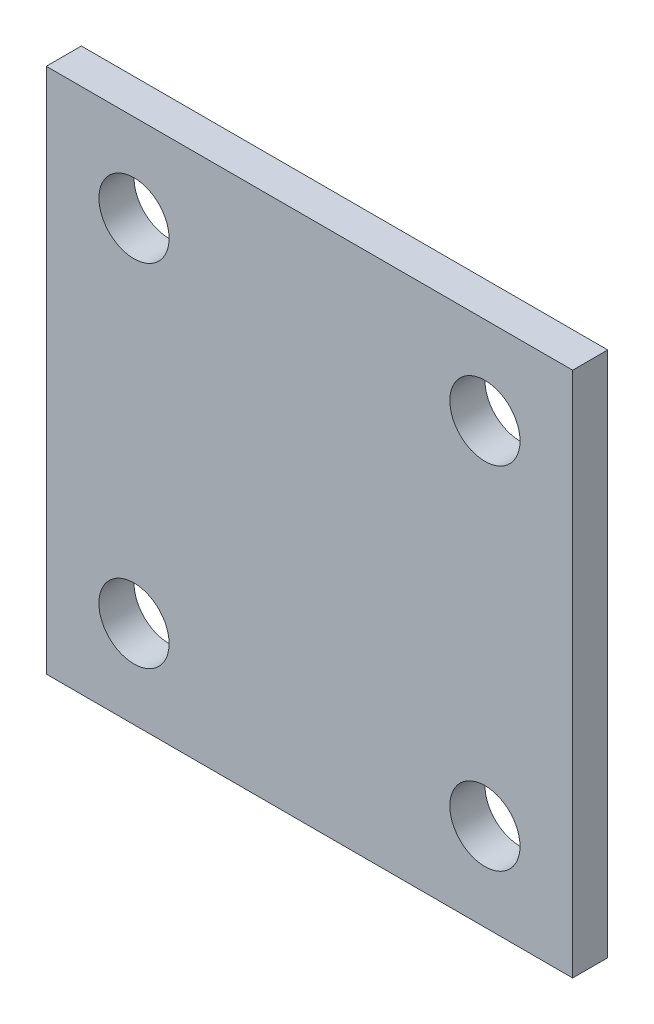
from build123d import *

# Parameters (mm, degrees)
SKETCH1_W           = 1500
SKETCH1_H           = 1500
SKETCH1_R           = 100
BOSS_EXTRUDE1_DEPTH = 100


with BuildPart() as part:
    # Sketch1 → Boss-Extrude1 (new body)
    with BuildSketch(Plane.XY):
        Rectangle(SKETCH1_W, SKETCH1_H)
        with Locations((-500, 500)):
            Circle(SKETCH1_R, mode=Mode.SUBTRACT)
        with Locations((500, 500)):
            Circle(SKETCH1_R, mode=Mode.SUBTRACT)
        with Locations((500, -500)):
            Circle(SKETCH1_R, mode=Mode.SUBTRACT)
        with Locations((-500, -500)):
            Circle(SKETCH1_R, mode=Mode.SUBTRACT)
    extrude(amount=BOSS_EXTRUDE1_DEPTH)


solid = part.part
